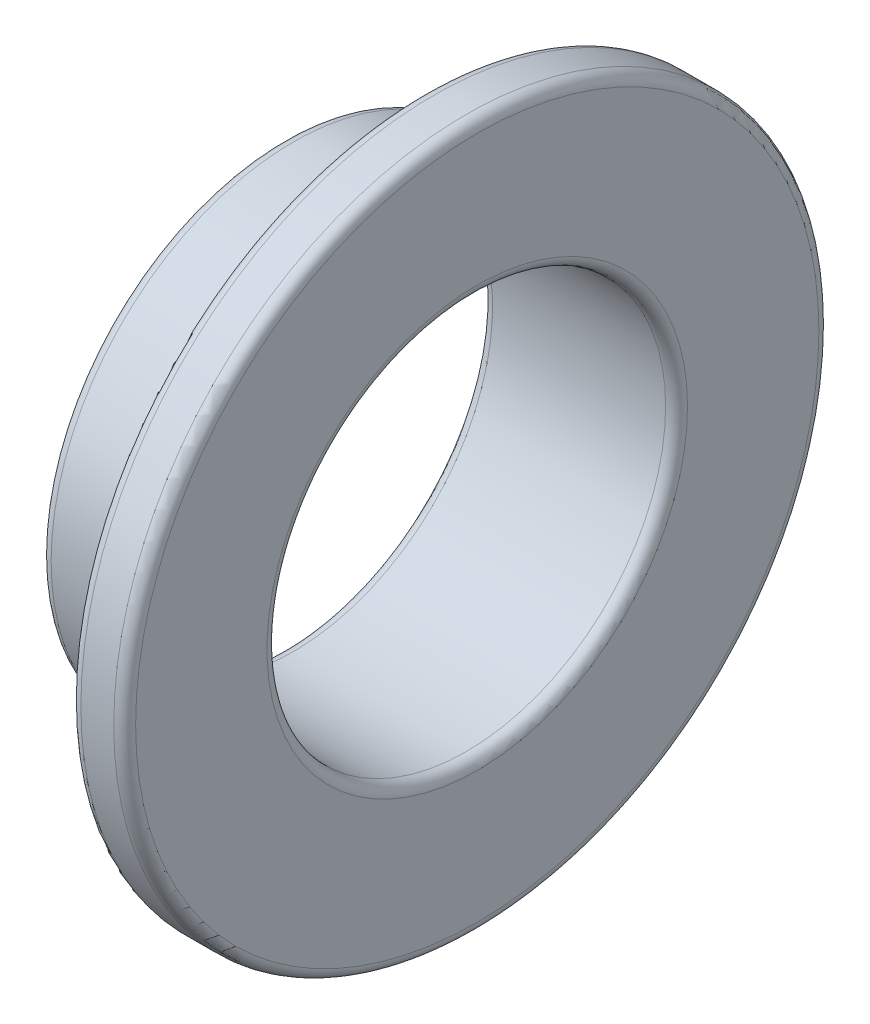
from build123d import *

# Parameters (mm, degrees)
FILLET1_R = 0.5


with BuildPart() as part:
    # Sketch1 → Revolve1 (revolve)
    with BuildSketch(Plane.XY, mode=Mode.PRIVATE) as revolve1_sk:
        Polygon((12.5, 16.1), (10, 16.1), (10, 13.6), (10, 11.06), (3.6, 11.06), (3.6, 9.1), (12.5, 9.1), align=None)
    revolve(revolve1_sk.sketch.rotate(Axis((-30.849638619, 0, 0), (1, 0, 0)), 90), axis=Axis((-30.849638619, 0, 0), (1, 0, 0)))

    # Fillet1
    fillet1_edges = [part.edges().sort_by_distance(p)[0] for p in [
        (10, 0, -16.1),
        (12.5, 0, -16.1),
        (12.5, 0, -9.1),
        (3.6, 0, -9.1),
        (3.6, 0, -11.06),
        (10, 0, -11.06),
    ]]
    fillet(fillet1_edges, radius=FILLET1_R)


solid = part.part
